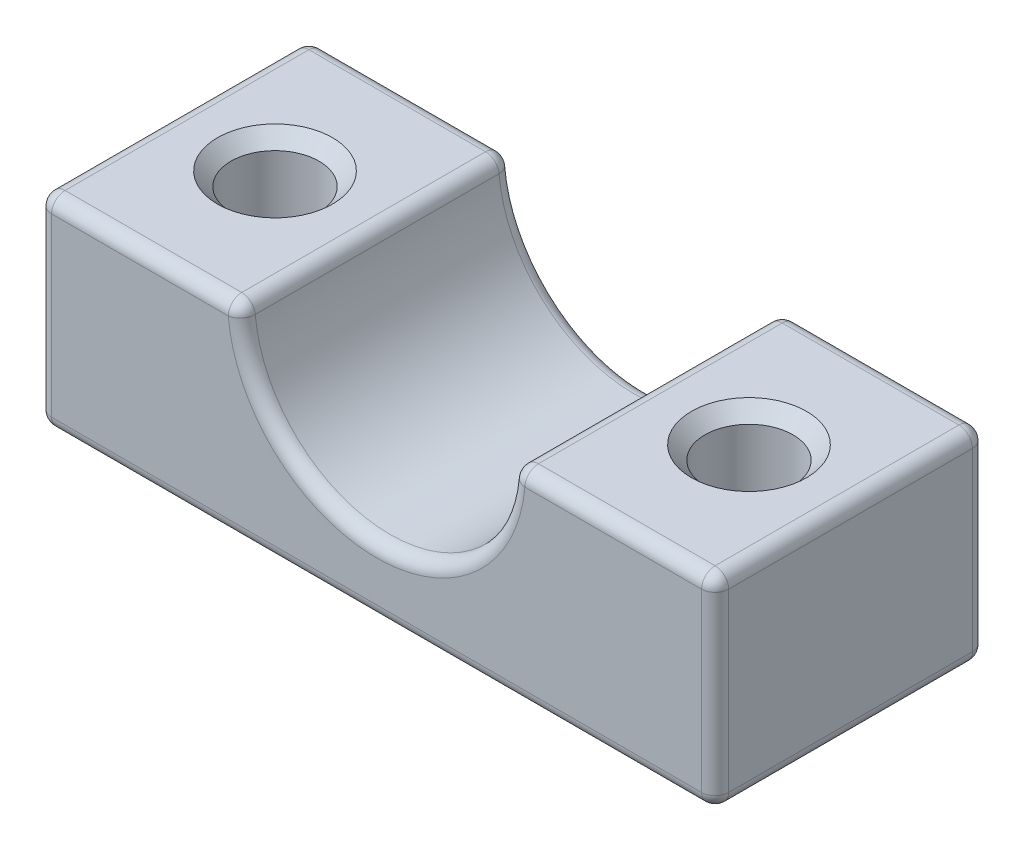
from build123d import *

# Parameters (mm, degrees)
DODANIE_WYCI_GNI_CIE1_DEPTH = 40
WYTNIJ_WYCI_GNI_CIE1_REACH  = 72.711
SZKIC2_R                    = 6.5
SFAZOWANIE1_SIZE            = 2
ZAOKR_GLENIE1_R             = 2


with BuildPart() as part:
    # Szkic1 → Dodanie-wyciągnięcie1 (new body)
    with BuildSketch(Plane.XY):
        with BuildLine():
            Line((50, 0), (20, 0))
            ThreePointArc((20, 0), (0, -20), (-20, 0))
            Line((-20, 0), (-50, 0))
            Line((-50, 0), (-50, -30))
            Line((-50, -30), (50, -30))
            Line((50, -30), (50, 0))
        make_face()
    extrude(amount=DODANIE_WYCI_GNI_CIE1_DEPTH)

    # Szkic2 → Wytnij-wyciągnięcie1 (cut, up to next)
    with BuildSketch(Plane(origin=(0, 0, 0), x_dir=(1, 0, 0), z_dir=(0, 1, 0)), mode=Mode.PRIVATE) as wytnij_wyci_gni_cie1_sk1:
        with Locations(Location((-35, -20, 0), (0, 0, 270))):
            Circle(SZKIC2_R)
    wytnij_wyci_gni_cie1_tool1 = extrude(wytnij_wyci_gni_cie1_sk1.sketch, amount=-WYTNIJ_WYCI_GNI_CIE1_REACH, mode=Mode.PRIVATE) & part.part
    # Szkic2 → Wytnij-wyciągnięcie1 (cut, up to next)
    with BuildSketch(Plane(origin=(0, 0, 0), x_dir=(1, 0, 0), z_dir=(0, 1, 0)), mode=Mode.PRIVATE) as wytnij_wyci_gni_cie1_sk2:
        with Locations(Location((35, -20, 0), (0, 0, 270))):
            Circle(SZKIC2_R)
    wytnij_wyci_gni_cie1_tool2 = extrude(wytnij_wyci_gni_cie1_sk2.sketch, amount=-WYTNIJ_WYCI_GNI_CIE1_REACH, mode=Mode.PRIVATE) & part.part
    add(wytnij_wyci_gni_cie1_tool1.solids().sort_by_distance((-35, 0, 20))[0], mode=Mode.SUBTRACT)
    add(wytnij_wyci_gni_cie1_tool2.solids().sort_by_distance((35, 0, 20))[0], mode=Mode.SUBTRACT)

    # Sfazowanie1
    sfazowanie1_edges = [part.edges().sort_by_distance(p)[0] for p in [
        (-35, 0, 13.5),
        (-35, -30, 13.5),
        (35, 0, 13.5),
        (35, -30, 13.5),
    ]]
    chamfer(sfazowanie1_edges, length=SFAZOWANIE1_SIZE)

    # Zaokrąglenie1
    zaokr_glenie1_edges = [part.edges().sort_by_distance(p)[0] for p in [
        (0, -20, 0),
        (-35, 0, 40),
        (20, 0, 20),
        (50, 0, 20),
        (50, -30, 20),
        (-50, -30, 20),
        (-50, 0, 20),
        (-20, 0, 20),
        (-50, -15, 40),
        (0, -30, 40),
        (50, -15, 40),
        (35, 0, 40),
        (0, -20, 40),
        (35, 0, 0),
        (50, -15, 0),
        (0, -30, 0),
        (-50, -15, 0),
        (-35, 0, 0),
    ]]
    fillet(zaokr_glenie1_edges, radius=ZAOKR_GLENIE1_R)


solid = part.part
